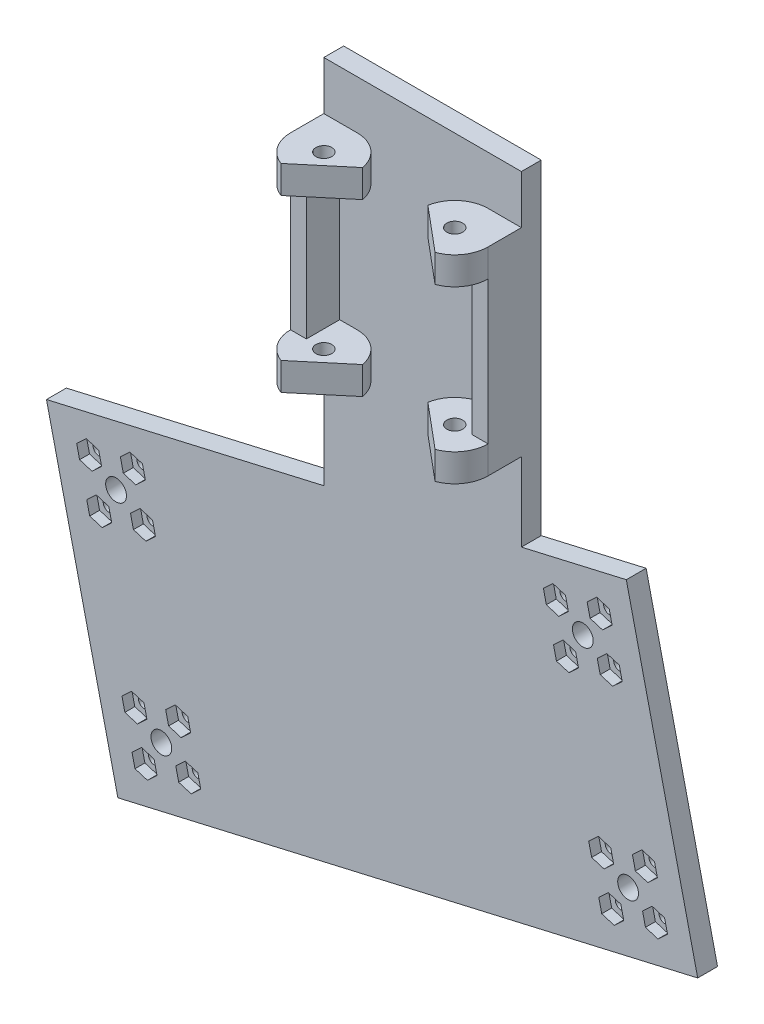
from build123d import *

# Parameters (mm, degrees)
BOSS_EXTRUDE2_DEPTH     = 7
CUT_EXTRUDE2_DEPTH      = 30.130224853
CUT_EXTRUDE2_DEPTH_BACK = 30.130224853
SKETCH3_R               = 2
BOSS_EXTRUDE3_DEPTH     = 36
SKETCH5_R               = 2
BOSS_EXTRUDE4_DEPTH     = 7
SKETCH13_W              = 49.8
SKETCH13_H              = 5
BOSS_EXTRUDE6_DEPTH     = 12.25
SKETCH15_W              = 49.8
SKETCH15_H              = 5
BOSS_EXTRUDE7_DEPTH     = 30
BOSS_EXTRUDE8_DEPTH     = 5
CUT_EXTRUDE3_DEPTH      = 158.990977444
CUT_EXTRUDE3_DEPTH_BACK = 158.990977444
SKETCH16_R              = 2.625
SKETCH16_R_2            = 1.5
CUT_EXTRUDE8_DEPTH      = 2.5


with BuildPart() as part:
    # Sketch1 → Boss-Extrude2 (new body)
    with BuildSketch(Plane(origin=(0, 0, 0), x_dir=(1, 0, 0), z_dir=(0, 1, 0))):
        with BuildLine():
            Line((-24.9, 0), (-24.9, 13.4))
            Line((-24.9, 13.4), (24.9, 13.4))
            Line((24.9, 13.4), (24.9, 0))
            ThreePointArc((24.9, 0), (23.392904185, -4.800819919), (19.412411454, -7.878950407))
            Line((19.412411454, -7.878950407), (8.235013612, 1.5))
            ThreePointArc((8.235013612, 1.5), (11.116692467, 6.448255578), (16.5, 8.4))
            Line((16.5, 8.4), (-16.5, 8.4))
            ThreePointArc((-16.5, 8.4), (-11.116692467, 6.448255578), (-8.235013612, 1.5))
            Line((-8.235013612, 1.5), (-19.412411454, -7.878950407))
            ThreePointArc((-19.412411454, -7.878950407), (-23.392904185, -4.800819919), (-24.9, 0))
        make_face()
    extrude(amount=BOSS_EXTRUDE2_DEPTH)

    # Sketch3 → Cut-Extrude2 (cut, two sides: drawn at the far end of the back side and taken through both)
    with BuildSketch(Plane(origin=(0, 7, 0), x_dir=(1, 0, 0), z_dir=(0, 1, 0)).offset(-CUT_EXTRUDE2_DEPTH_BACK)):
        with Locations(Location((-16.5, 0, 0), (0, 0, 270))):
            Circle(SKETCH3_R)
        with Locations(Location((16.5, 0, 0), (0, 0, 270))):
            Circle(SKETCH3_R)
    extrude(amount=CUT_EXTRUDE2_DEPTH + CUT_EXTRUDE2_DEPTH_BACK, mode=Mode.SUBTRACT)

    # Sketch4 → Boss-Extrude3 (add)
    with BuildSketch(Plane(origin=(0, 7, 0), x_dir=(1, 0, 0), z_dir=(0, 1, 0))):
        Polygon((-24.9, 13.4), (-24.9, 0), (-20.9, 0), (-20.9, 8.4), (-16.5, 8.4), (16.5, 8.4), (20.9, 8.4), (20.9, 0), (24.9, 0), (24.9, 13.4), align=None)
    extrude(amount=BOSS_EXTRUDE3_DEPTH)

    # Sketch5 → Boss-Extrude4 (add)
    with BuildSketch(Plane(origin=(0, 43, 0), x_dir=(1, 0, 0), z_dir=(0, 1, 0))):
        with BuildLine():
            Line((-24.9, 13.4), (-24.9, 0))
            ThreePointArc((-24.9, 0), (-23.392904185, -4.800819919), (-19.412411454, -7.878950407))
            Line((-19.412411454, -7.878950407), (-8.235013612, 1.5))
            ThreePointArc((-8.235013612, 1.5), (-11.116692467, 6.448255578), (-16.5, 8.4))
            Line((-16.5, 8.4), (16.5, 8.4))
            ThreePointArc((16.5, 8.4), (11.116692467, 6.448255578), (8.235013612, 1.5))
            Line((8.235013612, 1.5), (19.412411454, -7.878950407))
            ThreePointArc((19.412411454, -7.878950407), (23.392904185, -4.800819919), (24.9, 0))
            Line((24.9, 0), (24.9, 13.4))
            Line((24.9, 13.4), (-24.9, 13.4))
        make_face()
        with Locations(Location((16.5, 0, 0), (0, 0, 270))):
            Circle(SKETCH5_R, mode=Mode.SUBTRACT)
        with Locations(Location((-16.5, 0, 0), (0, 0, 270))):
            Circle(SKETCH5_R, mode=Mode.SUBTRACT)
    extrude(amount=BOSS_EXTRUDE4_DEPTH)

    # Sketch13 → Boss-Extrude6 (add)
    with BuildSketch(Plane(origin=(0, 50, 0), x_dir=(1, 0, 0), z_dir=(0, 1, 0))):
        with Locations((0, 10.9)):
            Rectangle(SKETCH13_W, SKETCH13_H)
    extrude(amount=BOSS_EXTRUDE6_DEPTH)

    # Sketch15 → Boss-Extrude7 (add)
    with BuildSketch(Plane.XZ):
        with Locations((0, -10.9)):
            Rectangle(SKETCH15_W, SKETCH15_H)
    extrude(amount=BOSS_EXTRUDE7_DEPTH)

    # Sketch12 → Boss-Extrude8 (add)
    with BuildSketch(Plane(origin=(0, 0, -13.4), x_dir=(-1, 0, 0), z_dir=(0, 0, -1))):
        Polygon((2.249510543, -26.004917311), (-51.34084302, -13.632609322), (-69.336927367, -91.582214505), (-15.746573804, -103.954522494), (76.818582351, -125.324872657), (94.814666698, -47.375267474), (24.9, -31.23419484), (24.9, -30), (19.554114826, -30), align=None)
    extrude(amount=-BOSS_EXTRUDE8_DEPTH)

    # Sketch16 → Cut-Extrude3 (cut, two sides: drawn at the far end of the back side and taken through both)
    with BuildSketch(Plane.XY.offset(-8.4).offset(-CUT_EXTRUDE3_DEPTH_BACK)):
        with Locations((40.380589992, -31.17268069)):
            Circle(SKETCH16_R)
        with Locations((47.164974761, -35.412034803)):
            Circle(SKETCH16_R_2)
        with Locations((36.141235878, -37.957065459)):
            Circle(SKETCH16_R_2)
        with Locations((33.596205223, -26.933326576)):
            Circle(SKETCH16_R_2)
        with Locations((44.619944106, -24.38829592)):
            Circle(SKETCH16_R_2)
        with Locations(Location((47.557501886, -87.406346247, 0), (0, 0, 180))):
            Circle(SKETCH16_R_2)
        with Locations(Location((45.012471231, -76.382607364, 0), (0, 0, 180))):
            Circle(SKETCH16_R_2)
        with Locations(Location((58.581240769, -84.861315591, 0), (0, 0, 180))):
            Circle(SKETCH16_R_2)
        with Locations(Location((56.036210114, -73.837576708, 0), (0, 0, 180))):
            Circle(SKETCH16_R_2)
        with Locations(Location((51.796856, -80.621961477, 0), (0, 0, 180))):
            Circle(SKETCH16_R)
        with Locations(Location((-73.035241217, -51.551135732, 0), (0, 0, 180))):
            Circle(SKETCH16_R_2)
        with Locations(Location((-84.0589801, -54.096166388, 0), (0, 0, 180))):
            Circle(SKETCH16_R_2)
        with Locations(Location((-81.513949445, -65.119905271, 0), (0, 0, 180))):
            Circle(SKETCH16_R_2)
        with Locations(Location((-77.274595331, -58.335520502, 0), (0, 0, 180))):
            Circle(SKETCH16_R)
        with Locations(Location((-70.490210562, -62.574874615, 0), (0, 0, 180))):
            Circle(SKETCH16_R_2)
        with Locations((-61.618975209, -101.00041652)):
            Circle(SKETCH16_R_2)
        with Locations((-72.642714092, -103.545447176)):
            Circle(SKETCH16_R_2)
        with Locations((-70.097683437, -114.569186059)):
            Circle(SKETCH16_R_2)
        with Locations((-65.858329323, -107.784801289)):
            Circle(SKETCH16_R)
        with Locations((-59.073944554, -112.024155403)):
            Circle(SKETCH16_R_2)
    extrude(amount=CUT_EXTRUDE3_DEPTH + CUT_EXTRUDE3_DEPTH_BACK, mode=Mode.SUBTRACT)

    # Sketch22 → Cut-Extrude8 (cut)
    with BuildSketch(Plane.XY.offset(-8.4)):
        Polygon((32.855914578, -23.726775506), (30.449105216, -25.971161546), (31.189395861, -29.177712615), (34.336495868, -30.139877645), (36.74330523, -27.895491605), (36.003014585, -24.688940536), align=None)
        Polygon((43.879653461, -21.181744851), (41.472844099, -23.42613089), (42.213134744, -26.63268196), (45.360234751, -27.59484699), (47.767044113, -25.35046095), (47.026753468, -22.143909881), align=None)
        Polygon((46.424684116, -32.205483734), (44.017874754, -34.449869774), (44.758165399, -37.656420843), (47.905265406, -38.618585873), (50.312074769, -36.374199833), (49.571784123, -33.167648764), align=None)
        Polygon((38.54804524, -35.712679419), (35.400945233, -34.750514389), (32.994135871, -36.994900429), (33.734426516, -40.201451498), (36.881526523, -41.163616528), (39.288335885, -38.919230489), align=None)
        Polygon((47.419280593, -74.138221324), (48.159571238, -77.344772393), (45.752761876, -79.589158433), (42.605661869, -78.626993403), (41.865371224, -75.420442334), (44.272180586, -73.176056294), align=None)
        Polygon((50.704601893, -88.368511276), (48.297792531, -90.612897316), (45.150692524, -89.650732286), (44.410401879, -86.444181217), (46.817211241, -84.199795177), (49.964311248, -85.161960207), align=None)
        Polygon((61.728340776, -85.823480621), (59.321531414, -88.067866661), (56.174431407, -87.105701631), (55.434140762, -83.899150561), (57.840950124, -81.654764522), (60.988050131, -82.616929552), align=None)
        Polygon((59.183310121, -74.799741738), (56.776500759, -77.044127778), (53.629400752, -76.081962748), (52.889110107, -72.875411678), (55.295919469, -70.631025639), (58.443019476, -71.593190669), align=None)
        Polygon((-73.244783444, -113.607021029), (-72.504492799, -116.813572098), (-69.357392792, -117.775737128), (-66.950583429, -115.531351088), (-67.690874075, -112.324800019), (-70.837974082, -111.362634989), align=None)
        Polygon((-62.221044561, -111.061990373), (-61.480753916, -114.268541443), (-58.333653908, -115.230706473), (-55.926844546, -112.986320433), (-56.667135192, -109.779769364), (-59.814235199, -108.817604334), align=None)
        Polygon((-75.789814099, -102.583282146), (-75.049523454, -105.789833215), (-71.902423447, -106.751998245), (-69.495614085, -104.507612205), (-70.23590473, -101.301061136), (-73.383004737, -100.338896106), align=None)
        Polygon((-62.359265854, -97.793865451), (-64.766075216, -100.03825149), (-64.025784571, -103.24480256), (-60.878684564, -104.20696759), (-58.471875202, -101.96258155), (-59.212165847, -98.756030481), align=None)
        Polygon((-72.897019924, -64.819260655), (-73.637310569, -61.612709586), (-71.230501207, -59.368323546), (-68.083401199, -60.330488576), (-67.343110554, -63.537039645), (-69.749919916, -65.781425685), align=None)
        Polygon((-76.182341224, -50.588970702), (-73.775531862, -48.344584663), (-70.628431855, -49.306749693), (-69.88814121, -52.513300762), (-72.294950572, -54.757686802), (-75.442050579, -53.795521772), align=None)
        Polygon((-84.661049452, -64.157740241), (-82.25424009, -61.913354201), (-79.107140083, -62.875519231), (-78.366849437, -66.082070301), (-80.773658799, -68.32645634), (-83.920758807, -67.36429131), align=None)
        Polygon((-87.206080107, -53.134001358), (-84.799270745, -50.889615318), (-81.652170738, -51.851780348), (-80.911880093, -55.058331418), (-83.318689455, -57.302717457), (-86.465789462, -56.340552427), align=None)
    extrude(amount=-CUT_EXTRUDE8_DEPTH, mode=Mode.SUBTRACT)


solid = part.part
